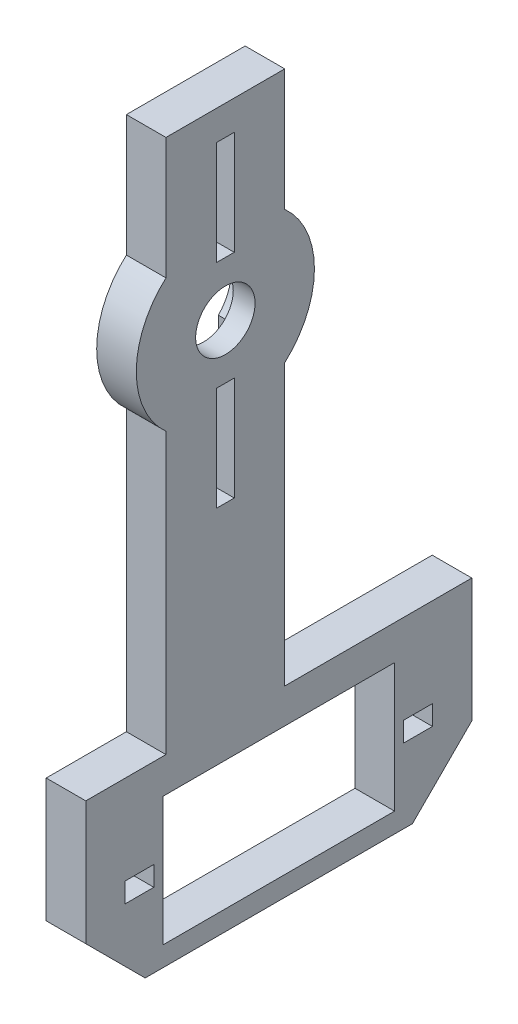
from build123d import *

# Parameters (mm, degrees)
BOSS_EXTRUDE1_START  = 66.4
SKETCH1_R            = 9
BOSS_EXTRUDE1_DEPTH  = 4
BOSS_EXTRUDE2_START  = -58
SKETCH2_W            = 4
SKETCH2_H            = 55
BOSS_EXTRUDE2_DEPTH  = 12
BOSS_EXTRUDE3_START  = -76.9
SKETCH3_W            = 4
SKETCH3_H            = 18.5
BOSS_EXTRUDE3_DEPTH  = 39
BOSS_EXTRUDE4_START  = 65.4
BOSS_EXTRUDE4_DEPTH  = 6
BOSS_EXTRUDE5_START  = 65.4
BOSS_EXTRUDE5_DEPTH  = 6
BOSS_EXTRUDE6_START  = 65.9
SKETCH6_R            = 4.6
BOSS_EXTRUDE6_DEPTH  = 2.3
BOSS_EXTRUDE7_START  = -55.3
SKETCH7_W            = 2.3
SKETCH7_H            = 17.5
BOSS_EXTRUDE7_DEPTH  = 6.6
BOSS_EXTRUDE8_START  = -52.9
SKETCH8_W            = 6
SKETCH8_H            = 10.5
BOSS_EXTRUDE8_DEPTH  = 1.8
BOSS_EXTRUDE9_START  = -55.3
SKETCH9_W            = 2.3
SKETCH9_H            = 17.5
BOSS_EXTRUDE9_DEPTH  = 6.6
BOSS_EXTRUDE10_START = -52.9
SKETCH10_W           = 6
SKETCH10_H           = 10.5
BOSS_EXTRUDE10_DEPTH = 1.8
BOSS_EXTRUDE11_START = 65.4
SKETCH11_R           = 3
BOSS_EXTRUDE11_DEPTH = 6
BOSS_EXTRUDE12_START = -69.1
SKETCH12_W           = 6
SKETCH12_H           = 13
BOSS_EXTRUDE12_DEPTH = 23.4
BOSS_EXTRUDE13_START = -72.925
SKETCH13_W           = 6
SKETCH13_H           = 2
BOSS_EXTRUDE13_DEPTH = 2.9
BOSS_EXTRUDE14_START = -44.775
SKETCH14_W           = 6
SKETCH14_H           = 2
BOSS_EXTRUDE14_DEPTH = 2.9


with BuildPart() as part:
    # Sketch1 → Boss-Extrude1 (new body)
    with BuildSketch(Plane(origin=(0, 0, 0), x_dir=(0, 0, -1), z_dir=(1, 0, 0)).offset(BOSS_EXTRUDE1_START)):
        with Locations((52, -20)):
            Circle(SKETCH1_R)
    extrude(amount=BOSS_EXTRUDE1_DEPTH)

    # Sketch2 → Boss-Extrude2 (add)
    with BuildSketch(Plane.XY.offset(BOSS_EXTRUDE2_START)):
        with Locations((68.4, -28.5)):
            Rectangle(SKETCH2_W, SKETCH2_H)
    extrude(amount=BOSS_EXTRUDE2_DEPTH)

    # Sketch3 → Boss-Extrude3 (add)
    with BuildSketch(Plane.XY.offset(BOSS_EXTRUDE3_START)):
        with Locations((68.4, -64.25)):
            Rectangle(SKETCH3_W, SKETCH3_H)
    extrude(amount=BOSS_EXTRUDE3_DEPTH)


with BuildPart() as body_2:
    # Sketch4 → Boss-Extrude4 (new body)
    with BuildSketch(Plane(origin=(0, 0, 0), x_dir=(0, 0, -1), z_dir=(1, 0, 0)).offset(BOSS_EXTRUDE4_START)):
        Polygon((36.9, -74.5), (44.9, -74.5), (36.9, -66.5), align=None)
    extrude(amount=BOSS_EXTRUDE4_DEPTH)


with BuildPart() as part_1:
    add(part.part)

    # Combine1: cut body 2
    add(body_2.part, mode=Mode.SUBTRACT)


with BuildPart() as body_2_2:
    # Sketch5 → Boss-Extrude5 (new body)
    with BuildSketch(Plane(origin=(0, 0, 0), x_dir=(0, 0, -1), z_dir=(1, 0, 0)).offset(BOSS_EXTRUDE5_START)):
        Polygon((77.9, -74.5), (69.9, -74.5), (77.9, -66.5), align=None)
    extrude(amount=BOSS_EXTRUDE5_DEPTH)


with BuildPart() as part_2:
    add(part_1.part)

    # Combine2: cut body 2 2
    add(body_2_2.part, mode=Mode.SUBTRACT)


with BuildPart() as body_2_3:
    # Sketch6 → Boss-Extrude6 (new body)
    with BuildSketch(Plane(origin=(0, 0, 0), x_dir=(0, 0, -1), z_dir=(1, 0, 0)).offset(BOSS_EXTRUDE6_START)):
        with Locations((52, -20)):
            Circle(SKETCH6_R)
    extrude(amount=BOSS_EXTRUDE6_DEPTH)


with BuildPart() as part_3:
    add(part_2.part)

    # Combine3: cut body 2 3
    add(body_2_3.part, mode=Mode.SUBTRACT)


with BuildPart() as body_2_4:
    # Sketch7 → Boss-Extrude7 (new body)
    with BuildSketch(Plane.XY.offset(BOSS_EXTRUDE7_START)):
        with Locations((67.05, -11.25)):
            Rectangle(SKETCH7_W, SKETCH7_H)
    extrude(amount=BOSS_EXTRUDE7_DEPTH)


with BuildPart() as part_4:
    add(part_3.part)

    # Combine4: cut body 2 4
    add(body_2_4.part, mode=Mode.SUBTRACT)


with BuildPart() as body_2_5:
    # Sketch8 → Boss-Extrude8 (new body)
    with BuildSketch(Plane.XY.offset(BOSS_EXTRUDE8_START)):
        with Locations((68.4, -9.25)):
            Rectangle(SKETCH8_W, SKETCH8_H)
    extrude(amount=BOSS_EXTRUDE8_DEPTH)


with BuildPart() as part_5:
    add(part_4.part)

    # Combine5: cut body 2 5
    add(body_2_5.part, mode=Mode.SUBTRACT)


with BuildPart() as body_2_6:
    # Sketch9 → Boss-Extrude9 (new body)
    with BuildSketch(Plane.XY.offset(BOSS_EXTRUDE9_START)):
        with Locations((67.05, -28.75)):
            Rectangle(SKETCH9_W, SKETCH9_H)
    extrude(amount=BOSS_EXTRUDE9_DEPTH)


with BuildPart() as part_6:
    add(part_5.part)

    # Combine6: cut body 2 6
    add(body_2_6.part, mode=Mode.SUBTRACT)


with BuildPart() as body_2_7:
    # Sketch10 → Boss-Extrude10 (new body)
    with BuildSketch(Plane.XY.offset(BOSS_EXTRUDE10_START)):
        with Locations((68.4, -30.75)):
            Rectangle(SKETCH10_W, SKETCH10_H)
    extrude(amount=BOSS_EXTRUDE10_DEPTH)


with BuildPart() as part_7:
    add(part_6.part)

    # Combine7: cut body 2 7
    add(body_2_7.part, mode=Mode.SUBTRACT)


with BuildPart() as body_2_8:
    # Sketch11 → Boss-Extrude11 (new body)
    with BuildSketch(Plane(origin=(0, 0, 0), x_dir=(0, 0, -1), z_dir=(1, 0, 0)).offset(BOSS_EXTRUDE11_START)):
        with Locations((52, -20)):
            Circle(SKETCH11_R)
    extrude(amount=BOSS_EXTRUDE11_DEPTH)


with BuildPart() as part_8:
    add(part_7.part)

    # Combine8: cut body 2 8
    add(body_2_8.part, mode=Mode.SUBTRACT)


with BuildPart() as body_2_9:
    # Sketch12 → Boss-Extrude12 (new body)
    with BuildSketch(Plane.XY.offset(BOSS_EXTRUDE12_START)):
        with Locations((68.4, -65)):
            Rectangle(SKETCH12_W, SKETCH12_H)
    extrude(amount=BOSS_EXTRUDE12_DEPTH)


with BuildPart() as part_9:
    add(part_8.part)

    # Combine9: cut body 2 9
    add(body_2_9.part, mode=Mode.SUBTRACT)


with BuildPart() as body_2_10:
    # Sketch13 → Boss-Extrude13 (new body)
    with BuildSketch(Plane.XY.offset(BOSS_EXTRUDE13_START)):
        with Locations((68.4, -65)):
            Rectangle(SKETCH13_W, SKETCH13_H)
    extrude(amount=BOSS_EXTRUDE13_DEPTH)


with BuildPart() as part_10:
    add(part_9.part)

    # Combine10: cut body 2 10
    add(body_2_10.part, mode=Mode.SUBTRACT)


with BuildPart() as body_2_11:
    # Sketch14 → Boss-Extrude14 (new body)
    with BuildSketch(Plane.XY.offset(BOSS_EXTRUDE14_START)):
        with Locations((68.4, -65)):
            Rectangle(SKETCH14_W, SKETCH14_H)
    extrude(amount=BOSS_EXTRUDE14_DEPTH)


with BuildPart() as part_11:
    add(part_10.part)

    # Combine11: cut body 2 11
    add(body_2_11.part, mode=Mode.SUBTRACT)


solid = part_11.part
